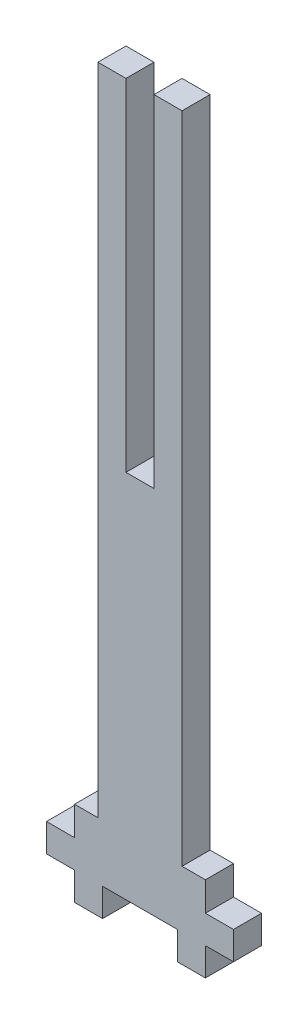
from build123d import *

# Parameters (mm, degrees)
EXTRUDE_1_DEPTH     = 3
SKETCH_2_W          = 3
SKETCH_2_H          = 36.495999937
CUT_EXTRUDE_1_DEPTH = 3
SKETCH_3_W          = 3
SKETCH_3_H          = 3
EXTRUDE_2_DEPTH     = 3
SKETCH_4_W          = 8
SKETCH_4_H          = 3.1
EXTRUDE_3_DEPTH     = 3


with BuildPart() as part:
    # 스케치1 → 보스-돌출1 (new body)
    with BuildSketch(Plane.XY):
        Polygon((-4.5, 39.545999937), (4.5, 39.545999937), (4.5, -30.445999937), (7, -30.445999937), (7, -39.545999937), (4, -39.545999937), (4, -33.445999937), (-4, -33.445999937), (-4, -39.545999937), (-7, -39.545999937), (-7, -30.445999937), (-4.5, -30.445999937), align=None)
    extrude(amount=EXTRUDE_1_DEPTH)

    # 스케치2 → 컷-돌출1 (cut)
    with BuildSketch(Plane.XY.offset(3)):
        with Locations((0, 21.297999969)):
            Rectangle(SKETCH_2_W, SKETCH_2_H)
    extrude(amount=-CUT_EXTRUDE_1_DEPTH, mode=Mode.SUBTRACT)

    # 스케치3 → 보스-돌출2 (add)
    with BuildSketch(Plane.XY.offset(3)):
        with Locations((-8.5, -35.045999937)):
            Rectangle(SKETCH_3_W, SKETCH_3_H)
        with Locations((8.5, -35.045999937)):
            Rectangle(SKETCH_3_W, SKETCH_3_H)
    extrude(amount=-EXTRUDE_2_DEPTH)

    # 스케치4 → 보스-돌출3 (add)
    with BuildSketch(Plane.XY.offset(3)):
        with Locations((0, -34.995999937)):
            Rectangle(SKETCH_4_W, SKETCH_4_H)
    extrude(amount=-EXTRUDE_3_DEPTH)


solid = part.part
